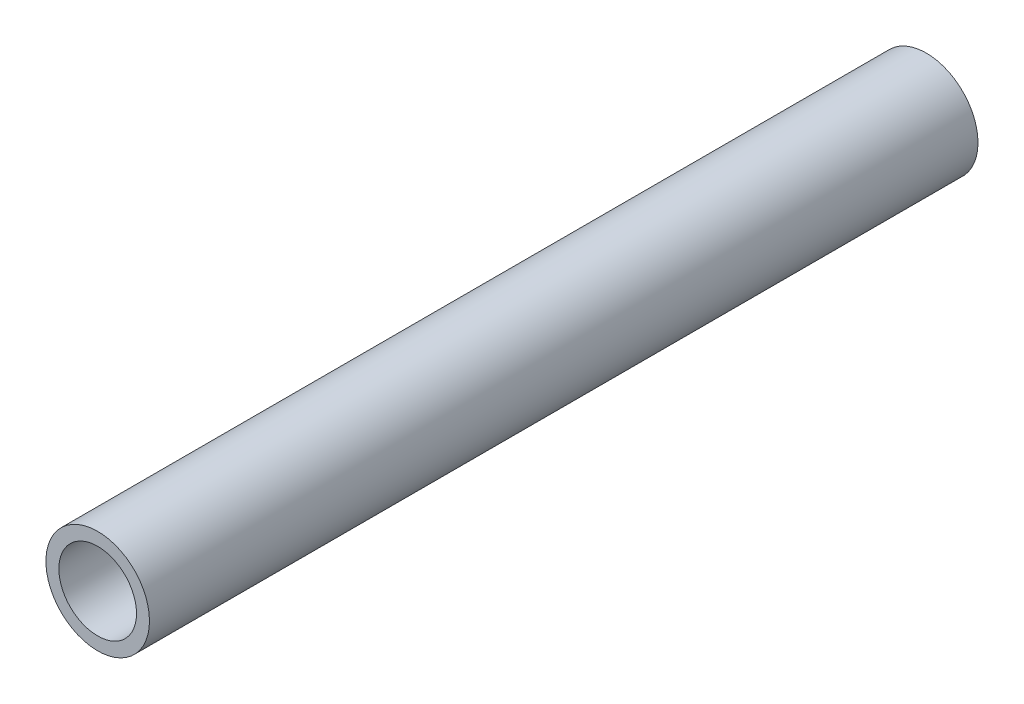
from build123d import *

# Parameters (mm, degrees)
SKETCH1_R           = 10
SKETCH1_R_2         = 7.5
BOSS_EXTRUDE1_DEPTH = 80


with BuildPart() as part:
    # Sketch1 → Boss-Extrude1 (new, symmetric)
    with BuildSketch(Plane.XY):
        Circle(SKETCH1_R)
        Circle(SKETCH1_R_2, mode=Mode.SUBTRACT)
    extrude(amount=BOSS_EXTRUDE1_DEPTH, both=True)


solid = part.part
